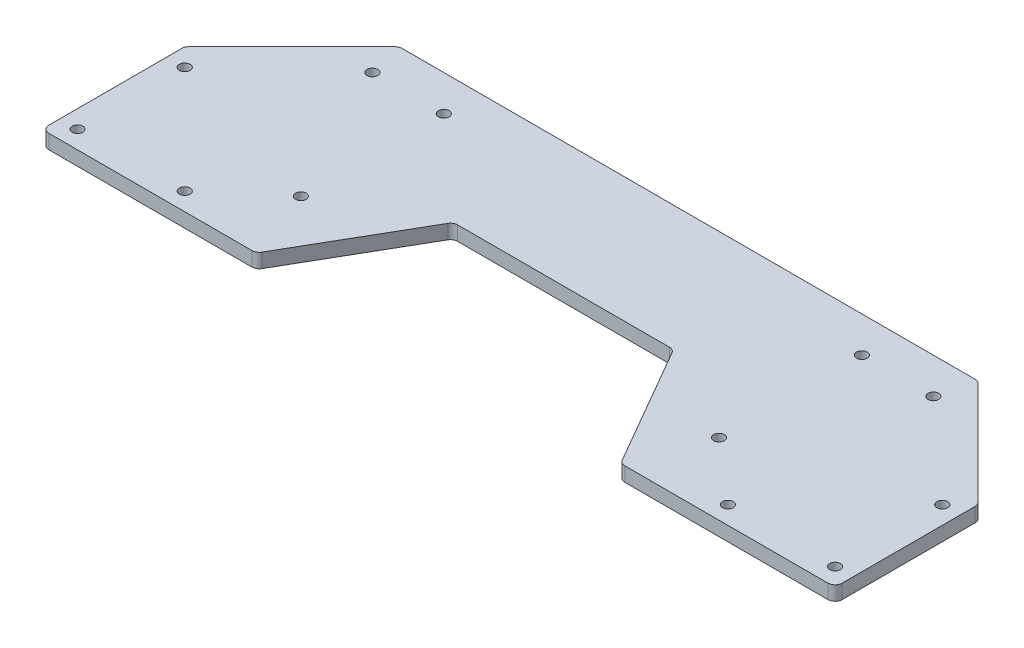
from build123d import *

# Parameters (mm, degrees)
EXTRUDE_1_DEPTH     = 4
SKETCH_2_R          = 1.5
CUT_EXTRUDE_1_DEPTH = 10
FILLET_2_R          = 2


with BuildPart() as part:
    # 草图1 → 凸台-拉伸1 (new body)
    with BuildSketch(Plane(origin=(0, 0, 0), x_dir=(1, 0, 0), z_dir=(0, 1, 0))):
        Polygon((-80.207259422, 5), (-80.207259422, -35), (-20.207259422, -35), (0, 0), (61.585481157, 0), (81.792740578, -35), (141.792740578, -35), (141.792740578, 5), (111.792740578, 35), (-50.207259422, 35), align=None)
    extrude(amount=EXTRUDE_1_DEPTH)

    # 草图2 → 切除-拉伸1 (cut)
    with BuildSketch(Plane(origin=(0, 4, 0), x_dir=(1, 0, 0), z_dir=(0, 1, 0))):
        with Locations(Location((-27.707259422, -15, 0), (0, 0, 270))):
            Circle(SKETCH_2_R)
        with Locations(Location((-27.707259422, 25, 0), (0, 0, 270))):
            Circle(SKETCH_2_R)
        with Locations(Location((-75.207259422, -30, 0), (0, 0, 270))):
            Circle(SKETCH_2_R)
        with Locations(Location((-45.207259422, -30, 0), (0, 0, 270))):
            Circle(SKETCH_2_R)
        with Locations(Location((-75.207259422, 0, 0), (0, 0, 270))):
            Circle(SKETCH_2_R)
        with Locations(Location((-47.707259422, 25, 0), (0, 0, 270))):
            Circle(SKETCH_2_R)
        with Locations(Location((109.292740578, 25, 0), (0, 0, 90))):
            Circle(SKETCH_2_R)
        with Locations(Location((136.792740578, 0, 0), (0, 0, 90))):
            Circle(SKETCH_2_R)
        with Locations(Location((106.792740578, -30, 0), (0, 0, 90))):
            Circle(SKETCH_2_R)
        with Locations(Location((136.792740578, -30, 0), (0, 0, 90))):
            Circle(SKETCH_2_R)
        with Locations(Location((89.292740578, 25, 0), (0, 0, 90))):
            Circle(SKETCH_2_R)
        with Locations(Location((89.292740578, -15, 0), (0, 0, 90))):
            Circle(SKETCH_2_R)
    extrude(amount=-CUT_EXTRUDE_1_DEPTH, mode=Mode.SUBTRACT)

    # 圆角2
    fillet_2_edges = [part.edges().sort_by_distance(p)[0] for p in [
        (-50.207259422, 2, -35),
        (111.792740578, 2, -35),
        (141.792740578, 2, -5),
        (141.792740578, 2, 35),
        (81.792740578, 2, 35),
        (61.585481157, 2, 0),
        (0, 2, 0),
        (-20.207259422, 2, 35),
        (-80.207259422, 2, 35),
        (-80.207259422, 2, -5),
    ]]
    fillet(fillet_2_edges, radius=FILLET_2_R)


solid = part.part
